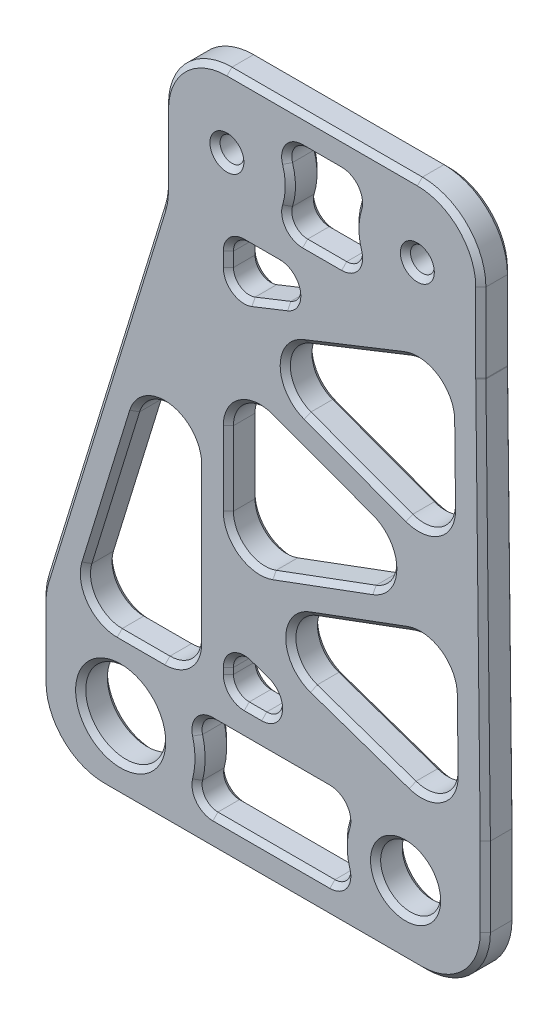
from build123d import *

# Parameters (mm, degrees)
SKETCH1_R           = 4
SKETCH1_R_2         = 3
SKETCH1_R_3         = 1.190625
BOSS_EXTRUDE1_DEPTH = 1.5875
FILLET1_R           = 6.35
FILLET3_R           = 3.175
FILLET2_R           = 1.5875
CHAMFER1_SIZE       = 0.508


with BuildPart() as part:
    # Sketch1 → Boss-Extrude1 (new, symmetric)
    with BuildSketch(Plane.XY):
        Polygon((15.875, 0), (-15.875, 0), (-15.875, -14.2875), (-28.12542, -54.12486), (-28.12542, -68.41236), (16.32458, -68.41236), (16.32458, -54.12486), (15.875, -14.2875), align=None)
        with Locations((-20.14982, -61.26861)):
            Circle(SKETCH1_R, mode=Mode.SUBTRACT)
        Polygon((-12.553271791, -54.12486), (-24.803691791, -54.12486), (-12.553271791, -14.2875), align=None, mode=Mode.SUBTRACT)
        with BuildLine():
            ThreePointArc((-13.275743357, -65.23736), (-12.21232, -61.26861), (-13.275743357, -57.29986))
            Line((-13.275743357, -57.29986), (3.392012839, -57.29986))
            ThreePointArc((3.392012839, -57.29986), (1.99898, -61.26861), (3.392012839, -65.23736))
            Line((3.392012839, -65.23736), (-13.275743357, -65.23736))
        make_face(mode=Mode.SUBTRACT)
        Polygon((-9.378271791, -49.708144558), (3.418196766, -54.12486), (-9.378271791, -54.12486), align=None, mode=Mode.SUBTRACT)
        with Locations((8.34898, -61.26861)):
            Circle(SKETCH1_R_2, mode=Mode.SUBTRACT)
        Polygon((12.968365445, -38.067407542), (13.14958, -54.12486), (-9.378271791, -46.349346745), align=None, mode=Mode.SUBTRACT)
        Polygon((-9.378271791, -42.963311587), (-9.378271791, -26.427639416), (12.930311889, -34.695475502), align=None, mode=Mode.SUBTRACT)
        with Locations((-9.525, -7.14375)):
            Circle(SKETCH1_R_3, mode=Mode.SUBTRACT)
        Polygon((-9.378271791, -23.041604258), (12.7, -14.2875), (12.891938678, -31.295218759), align=None, mode=Mode.SUBTRACT)
        Polygon((-9.378271791, -19.626132417), (-9.378271791, -14.2875), (4.086015818, -14.2875), align=None, mode=Mode.SUBTRACT)
        with BuildLine():
            ThreePointArc((-4.568032839, -11.1125), (-3.175, -7.14375), (-4.568032839, -3.175))
            Line((-4.568032839, -3.175), (4.568032839, -3.175))
            ThreePointArc((4.568032839, -3.175), (3.175, -7.14375), (4.568032839, -11.1125))
            Line((4.568032839, -11.1125), (-4.568032839, -11.1125))
        make_face(mode=Mode.SUBTRACT)
        with Locations((9.525, -7.14375)):
            Circle(SKETCH1_R_3, mode=Mode.SUBTRACT)
    extrude(amount=BOSS_EXTRUDE1_DEPTH, both=True)

    # Fillet1
    fillet1_edges = [part.edges().sort_by_distance(p)[0] for p in [
        (-15.875, 0, 0),
        (15.875, 0, 0),
        (15.875, -14.2875, 0),
        (16.32458, -68.41236, 0),
        (-28.12542, -68.41236, 0),
        (-28.12542, -54.12486, 0),
        (-15.875, -14.2875, 0),
    ]]
    fillet(fillet1_edges, radius=FILLET1_R)

    # Fillet3
    fillet3_edges = [part.edges().sort_by_distance(p)[0] for p in [
        (-24.803691791, -54.12486, 0),
        (-12.553271791, -54.12486, 0),
        (-12.553271791, -14.2875, 0),
        (-9.378271791, -46.349346745, 0),
        (13.14958, -54.12486, 0),
        (12.968365445, -38.067407542, 0),
        (12.891938678, -31.295218759, 0),
        (12.7, -14.2875, 0),
        (-9.378271791, -23.041604258, 0),
        (-9.378271791, -42.963311587, 0),
        (12.930311889, -34.695475502, 0),
        (-9.378271791, -26.427639416, 0),
    ]]
    fillet(fillet3_edges, radius=FILLET3_R)

    # Fillet2
    fillet2_edges = [part.edges().sort_by_distance(p)[0] for p in [
        (-13.275743357, -57.29986, 0),
        (-13.275743357, -65.23736, 0),
        (3.392012839, -65.23736, 0),
        (3.392012839, -57.29986, 0),
        (-9.378271791, -49.708144558, 0),
        (-9.378271791, -54.12486, 0),
        (3.418196766, -54.12486, 0),
        (-9.378271791, -14.2875, 0),
        (-9.378271791, -19.626132417, 0),
        (4.086015818, -14.2875, 0),
        (-4.568032839, -3.175, 0),
        (-4.568032839, -11.1125, 0),
        (4.568032839, -11.1125, 0),
        (4.568032839, -3.175, 0),
    ]]
    fillet(fillet2_edges, radius=FILLET2_R)

    # Chamfer1
    chamfer1_edges = [part.edges().sort_by_distance(p)[0] for p in [
        (-15.875, -9.841601911, -1.5875),
        (-15.875, -9.841601911, 1.5875),
        (0, 0, -1.5875),
        (15.875, -10.31875, -1.5875),
        (16.32458, -58.09361, -1.5875),
        (-5.90042, -68.41236, -1.5875),
        (-28.12542, -58.570758089, -1.5875),
        (-22.00021, -34.20618, -1.5875),
        (-28.054905028, -54.135457192, -1.5875),
        (-26.265548061, -66.552488061, -1.5875),
        (14.464708061, -66.552488061, -1.5875),
        (14.015128061, -1.859871939, -1.5875),
        (-14.015128061, -1.859871939, -1.5875),
        (0, 0, 1.5875),
        (-22.00021, -34.20618, 1.5875),
        (-28.12542, -58.570758089, 1.5875),
        (-5.90042, -68.41236, 1.5875),
        (16.32458, -58.09361, 1.5875),
        (15.875, -10.31875, 1.5875),
        (-28.054905028, -54.135457192, 1.5875),
        (-26.265548061, -66.552488061, 1.5875),
        (14.464708061, -66.552488061, 1.5875),
        (14.015128061, -1.859871939, 1.5875),
        (-14.015128061, -1.859871939, 1.5875),
        (16.09979, -34.20618, -1.5875),
        (16.09979, -34.20618, 1.5875),
        (-15.945514972, -14.276902808, -1.5875),
        (-15.945514972, -14.276902808, 1.5875),
        (-0.10128663, -29.865804464, -1.5875),
        (-0.10128663, -29.865804464, 1.5875),
        (-9.378271791, -34.695475502, -1.5875),
        (-9.378271791, -34.695475502, 1.5875),
        (-0.10128663, -39.525146539, -1.5875),
        (-0.10128663, -39.525146539, 1.5875),
        (-21.151697335, -42.248873882, -1.5875),
        (-21.151697335, -42.248873882, 1.5875),
        (-18.116944229, -54.12486, -1.5875),
        (-18.116944229, -54.12486, 1.5875),
        (16.09979, -34.20618, 1.5875),
        (-12.553271791, -43.182093356, -1.5875),
        (-12.553271791, -43.182093356, 1.5875),
        (3.841364052, -41.449986757, -1.5875),
        (3.841364052, -41.449986757, 1.5875),
        (3.948565436, -50.949119527, -1.5875),
        (3.948565436, -50.949119527, 1.5875),
        (13.058972722, -46.096133771, -1.5875),
        (13.058972722, -46.096133771, 1.5875),
        (3.473191475, -27.804514951, -1.5875),
        (3.473191475, -27.804514951, 1.5875),
        (12.795969339, -22.79135938, -1.5875),
        (12.795969339, -22.79135938, 1.5875),
        (3.362429483, -17.989876101, -1.5875),
        (3.362429483, -17.989876101, 1.5875),
        (-8.016758506, -28.384243052, -1.5875),
        (-8.016758506, -28.384243052, 1.5875),
        (6.968985543, -34.695475502, -1.5875),
        (6.968985543, -34.695475502, 1.5875),
        (-8.016758506, -41.006707951, -1.5875),
        (-8.016758506, -41.006707951, 1.5875),
        (-23.059397867, -52.836345246, -1.5875),
        (-23.059397867, -52.836345246, 1.5875),
        (-13.48320776, -53.19492403, -1.5875),
        (-13.48320776, -53.19492403, 1.5875),
        (-15.256422297, -32.274584198, -1.5875),
        (-15.256422297, -32.274584198, 1.5875),
        (-3.129798547, -46.27883031, -1.5875),
        (-3.129798547, -46.27883031, 1.5875),
        (11.781247601, -52.227774089, -1.5875),
        (11.781247601, -52.227774089, 1.5875),
        (11.643194785, -39.994890676, -1.5875),
        (11.643194785, -39.994890676, 1.5875),
        (11.49318993, -29.309102149, -1.5875),
        (11.49318993, -29.309102149, 1.5875),
        (11.346429974, -16.304677591, -1.5875),
        (11.346429974, -16.304677591, 1.5875),
        (-3.686729116, -22.977373, -1.5875),
        (-3.686729116, -22.977373, 1.5875),
        (-6.400906525, -50.735785511, -1.5875),
        (-6.400906525, -50.735785511, 1.5875),
        (-9.378271791, -52.236415433, -1.5875),
        (-9.378271791, -52.236415433, 1.5875),
        (-6.918850622, -54.12486, -1.5875),
        (-6.918850622, -54.12486, 1.5875),
        (-6.007749691, -14.2875, -1.5875),
        (-6.007749691, -14.2875, 1.5875),
        (-9.378271791, -16.581973875, -1.5875),
        (-9.378271791, -16.581973875, 1.5875),
        (-5.422618305, -18.057703359, -1.5875),
        (-5.422618305, -18.057703359, 1.5875),
        (-5.075095409, -65.23736, -1.5875),
        (-5.075095409, -65.23736, 1.5875),
        (1.99898, -61.26861, -1.5875),
        (1.99898, -61.26861, 1.5875),
        (-5.075095409, -57.29986, -1.5875),
        (-5.075095409, -57.29986, 1.5875),
        (-12.21232, -61.26861, -1.5875),
        (-12.21232, -61.26861, 1.5875),
        (0, -11.1125, -1.5875),
        (0, -11.1125, 1.5875),
        (3.175, -7.14375, -1.5875),
        (3.175, -7.14375, 1.5875),
        (0, -3.175, -1.5875),
        (0, -3.175, 1.5875),
        (-3.175, -7.14375, -1.5875),
        (-3.175, -7.14375, 1.5875),
        (-8.712162044, -50.642723307, -1.5875),
        (-8.712162044, -50.642723307, 1.5875),
        (-8.913303806, -53.659892015, -1.5875),
        (-8.913303806, -53.659892015, 1.5875),
        (-4.481297592, -52.79994927, -1.5875),
        (-4.481297592, -52.79994927, 1.5875),
        (-8.913303806, -14.752467985, -1.5875),
        (-8.913303806, -14.752467985, 1.5875),
        (-8.682752781, -18.602159904, -1.5875),
        (-8.682752781, -18.602159904, 1.5875),
        (-2.665420565, -15.577144588, -1.5875),
        (-2.665420565, -15.577144588, 1.5875),
        (2.056971006, -64.589037666, -1.5875),
        (2.056971006, -64.589037666, 1.5875),
        (2.056971006, -57.948182334, -1.5875),
        (2.056971006, -57.948182334, 1.5875),
        (-12.182307353, -64.622001242, -1.5875),
        (-12.182307353, -64.622001242, 1.5875),
        (-12.182307353, -57.915218758, -1.5875),
        (-12.182307353, -57.915218758, 1.5875),
        (3.232991006, -10.464177666, -1.5875),
        (3.232991006, -10.464177666, 1.5875),
        (3.232991006, -3.823322334, -1.5875),
        (3.232991006, -3.823322334, 1.5875),
        (-3.232991006, -10.464177666, -1.5875),
        (-3.232991006, -10.464177666, 1.5875),
        (-3.232991006, -3.823322334, -1.5875),
        (-3.232991006, -3.823322334, 1.5875),
        (-24.14982, -61.26861, -1.5875),
        (-24.14982, -61.26861, 1.5875),
        (5.34898, -61.26861, -1.5875),
        (5.34898, -61.26861, 1.5875),
        (-10.715625, -7.14375, -1.5875),
        (-10.715625, -7.14375, 1.5875),
        (8.334375, -7.14375, -1.5875),
        (8.334375, -7.14375, 1.5875),
        (16.09979, -34.20618, -1.5875),
    ]]
    chamfer(chamfer1_edges, length=CHAMFER1_SIZE)


solid = part.part
